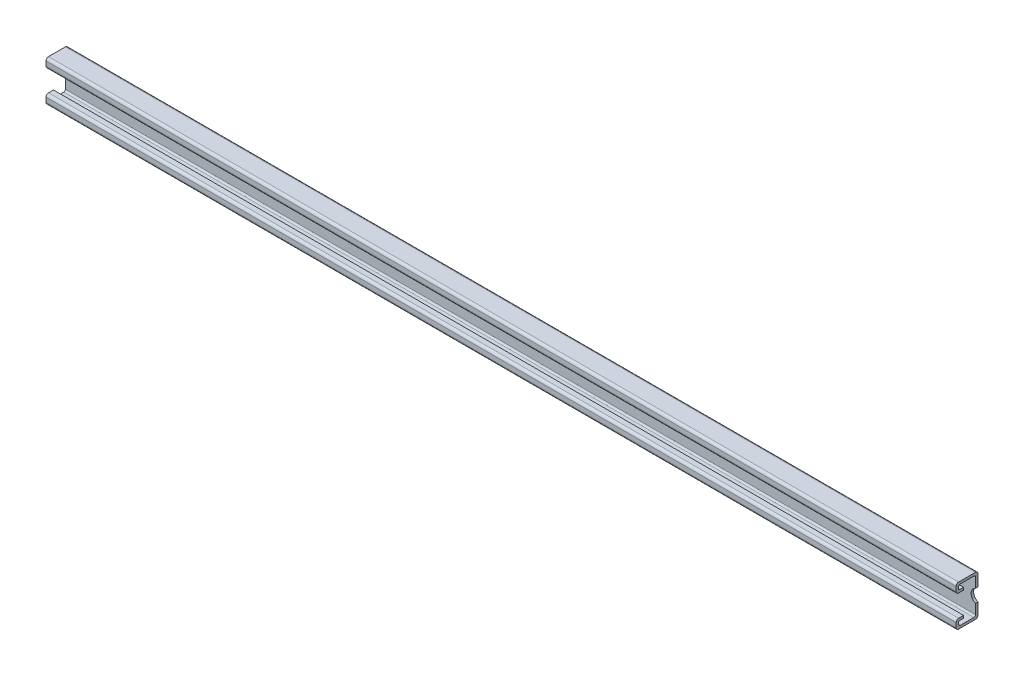
from build123d import *

# Parameters (mm, degrees)
SKETCH1_W           = 1000
SKETCH1_H           = 41
BOSS_EXTRUDE1_DEPTH = 22
CUT_EXTRUDE1_DEPTH  = 1001.900594465
SKETCH3_W           = 1000
SKETCH3_H           = 2.5
BOSS_EXTRUDE2_DEPTH = 5
CUT_EXTRUDE2_DEPTH  = 1002.08191473
CUT_EXTRUDE3_DEPTH  = 1002.08191473
CUT_EXTRUDE4_DEPTH  = 1002.08191473
CUT_EXTRUDE5_DEPTH  = 1002.08191473
CUT_EXTRUDE6_DEPTH  = 1002.08191473
CUT_EXTRUDE7_DEPTH  = 1002.08191473
CUT_EXTRUDE8_DEPTH  = 1002.08191473
CUT_EXTRUDE9_DEPTH  = 1002.08191473
CUT_EXTRUDE10_DEPTH = 1002.08191473
CUT_EXTRUDE11_DEPTH = 1002.08191473
CUT_EXTRUDE12_DEPTH = 1002.08191473
CUT_EXTRUDE13_DEPTH = 1002.08191473
CUT_EXTRUDE14_DEPTH = 1002.08191473
CUT_EXTRUDE15_DEPTH = 1002.08191473
CUT_EXTRUDE16_DEPTH = 1002.08191473
CUT_EXTRUDE17_DEPTH = 1002.08191473
CUT_EXTRUDE18_DEPTH = 1002.08191473
CUT_EXTRUDE19_DEPTH = 1002.08191473
CUT_EXTRUDE20_DEPTH = 1002.08191473
CUT_EXTRUDE21_DEPTH = 1002.08191473
FILLET1_R           = 1.2
FILLET2_R           = 1.6
FILLET3_R           = 2.5
SKETCH24_W          = 85.6
SKETCH24_H          = 22
CUT_EXTRUDE22_DEPTH = 1001.900594465


with BuildPart() as part:
    # Sketch1 → Boss-Extrude1 (new body)
    with BuildSketch(Plane(origin=(0, 0, -11), x_dir=(-1, 0, 0), z_dir=(0, 0, -1))):
        with Locations((-500, 20.5)):
            Rectangle(SKETCH1_W, SKETCH1_H)
    extrude(amount=-BOSS_EXTRUDE1_DEPTH)

    # Sketch2 → Cut-Extrude1 (cut, through all)
    with BuildSketch(Plane(origin=(1000, 0, 0), x_dir=(0, 0, -1), z_dir=(1, 0, 0))):
        Polygon((-11, 9.5), (-3.5, 9.5), (-3.5, 7), (-8.5, 7), (-8.5, 2.5), (8.5, 2.5), (8.5, 38.5), (-8.5, 38.5), (-8.5, 31.5), (-11, 31.5), align=None)
    extrude(amount=-CUT_EXTRUDE1_DEPTH, mode=Mode.SUBTRACT)

    # Sketch3 → Boss-Extrude2 (add)
    with BuildSketch(Plane(origin=(0, 0, 8.5), x_dir=(-1, 0, 0), z_dir=(0, 0, -1))):
        with Locations((-500, 32.75)):
            Rectangle(SKETCH3_W, SKETCH3_H)
    extrude(amount=BOSS_EXTRUDE2_DEPTH)

    # Sketch4 → Cut-Extrude2 (cut, through all)
    with BuildSketch(Plane(origin=(0, 0, -11), x_dir=(-1, 0, 0), z_dir=(0, 0, -1))):
        with BuildLine():
            Line((-117, 27.5), (-133, 27.5))
            ThreePointArc((-133, 27.5), (-140, 20.5), (-133, 13.5))
            Line((-133, 13.5), (-117, 13.5))
            ThreePointArc((-117, 13.5), (-110, 20.5), (-117, 27.5))
        make_face()
    extrude(amount=-CUT_EXTRUDE2_DEPTH, mode=Mode.SUBTRACT)

    # Sketch5 → Cut-Extrude3 (cut, through all)
    with BuildSketch(Plane(origin=(0, 0, -11), x_dir=(-1, 0, 0), z_dir=(0, 0, -1))):
        with BuildLine():
            Line((-217, 27.5), (-233, 27.5))
            ThreePointArc((-233, 27.5), (-240, 20.5), (-233, 13.5))
            Line((-233, 13.5), (-217, 13.5))
            ThreePointArc((-217, 13.5), (-210, 20.5), (-217, 27.5))
        make_face()
    extrude(amount=-CUT_EXTRUDE3_DEPTH, mode=Mode.SUBTRACT)

    # Sketch6 → Cut-Extrude4 (cut, through all)
    with BuildSketch(Plane(origin=(0, 0, -11), x_dir=(-1, 0, 0), z_dir=(0, 0, -1))):
        with BuildLine():
            Line((-317, 27.5), (-333, 27.5))
            ThreePointArc((-333, 27.5), (-340, 20.5), (-333, 13.5))
            Line((-333, 13.5), (-317, 13.5))
            ThreePointArc((-317, 13.5), (-310, 20.5), (-317, 27.5))
        make_face()
    extrude(amount=-CUT_EXTRUDE4_DEPTH, mode=Mode.SUBTRACT)

    # Sketch7 → Cut-Extrude5 (cut, through all)
    with BuildSketch(Plane(origin=(0, 0, -11), x_dir=(-1, 0, 0), z_dir=(0, 0, -1))):
        with BuildLine():
            Line((-417, 27.5), (-433, 27.5))
            ThreePointArc((-433, 27.5), (-440, 20.5), (-433, 13.5))
            Line((-433, 13.5), (-417, 13.5))
            ThreePointArc((-417, 13.5), (-410, 20.5), (-417, 27.5))
        make_face()
    extrude(amount=-CUT_EXTRUDE5_DEPTH, mode=Mode.SUBTRACT)

    # Sketch8 → Cut-Extrude6 (cut, through all)
    with BuildSketch(Plane(origin=(0, 0, -11), x_dir=(-1, 0, 0), z_dir=(0, 0, -1))):
        with BuildLine():
            Line((-517, 27.5), (-533, 27.5))
            ThreePointArc((-533, 27.5), (-540, 20.5), (-533, 13.5))
            Line((-533, 13.5), (-517, 13.5))
            ThreePointArc((-517, 13.5), (-510, 20.5), (-517, 27.5))
        make_face()
    extrude(amount=-CUT_EXTRUDE6_DEPTH, mode=Mode.SUBTRACT)

    # Sketch9 → Cut-Extrude7 (cut, through all)
    with BuildSketch(Plane(origin=(0, 0, -11), x_dir=(-1, 0, 0), z_dir=(0, 0, -1))):
        with BuildLine():
            Line((-617, 27.5), (-633, 27.5))
            ThreePointArc((-633, 27.5), (-640, 20.5), (-633, 13.5))
            Line((-633, 13.5), (-617, 13.5))
            ThreePointArc((-617, 13.5), (-610, 20.5), (-617, 27.5))
        make_face()
    extrude(amount=-CUT_EXTRUDE7_DEPTH, mode=Mode.SUBTRACT)

    # Sketch10 → Cut-Extrude8 (cut, through all)
    with BuildSketch(Plane(origin=(0, 0, -11), x_dir=(-1, 0, 0), z_dir=(0, 0, -1))):
        with BuildLine():
            Line((-717, 27.5), (-733, 27.5))
            ThreePointArc((-733, 27.5), (-740, 20.5), (-733, 13.5))
            Line((-733, 13.5), (-717, 13.5))
            ThreePointArc((-717, 13.5), (-710, 20.5), (-717, 27.5))
        make_face()
    extrude(amount=-CUT_EXTRUDE8_DEPTH, mode=Mode.SUBTRACT)

    # Sketch11 → Cut-Extrude9 (cut, through all)
    with BuildSketch(Plane(origin=(0, 0, -11), x_dir=(-1, 0, 0), z_dir=(0, 0, -1))):
        with BuildLine():
            Line((-817, 27.5), (-833, 27.5))
            ThreePointArc((-833, 27.5), (-840, 20.5), (-833, 13.5))
            Line((-833, 13.5), (-817, 13.5))
            ThreePointArc((-817, 13.5), (-810, 20.5), (-817, 27.5))
        make_face()
    extrude(amount=-CUT_EXTRUDE9_DEPTH, mode=Mode.SUBTRACT)

    # Sketch12 → Cut-Extrude10 (cut, through all)
    with BuildSketch(Plane(origin=(0, 0, -11), x_dir=(-1, 0, 0), z_dir=(0, 0, -1))):
        with BuildLine():
            Line((-917, 27.5), (-933, 27.5))
            ThreePointArc((-933, 27.5), (-940, 20.5), (-933, 13.5))
            Line((-933, 13.5), (-917, 13.5))
            ThreePointArc((-917, 13.5), (-910, 20.5), (-917, 27.5))
        make_face()
    extrude(amount=-CUT_EXTRUDE10_DEPTH, mode=Mode.SUBTRACT)

    # Sketch13 → Cut-Extrude11 (cut, through all)
    with BuildSketch(Plane(origin=(0, 0, -11), x_dir=(-1, 0, 0), z_dir=(0, 0, -1))):
        with BuildLine():
            Line((-17, 27.5), (-33, 27.5))
            ThreePointArc((-33, 27.5), (-40, 20.5), (-33, 13.5))
            Line((-33, 13.5), (-17, 13.5))
            ThreePointArc((-17, 13.5), (-10, 20.5), (-17, 27.5))
        make_face()
    extrude(amount=-CUT_EXTRUDE11_DEPTH, mode=Mode.SUBTRACT)

    # Sketch14 → Cut-Extrude12 (cut, through all)
    with BuildSketch(Plane(origin=(0, 0, -11), x_dir=(-1, 0, 0), z_dir=(0, 0, -1))):
        with BuildLine():
            Line((-967, 27.5), (-983, 27.5))
            ThreePointArc((-983, 27.5), (-990, 20.5), (-983, 13.5))
            Line((-983, 13.5), (-967, 13.5))
            ThreePointArc((-967, 13.5), (-960, 20.5), (-967, 27.5))
        make_face()
    extrude(amount=-CUT_EXTRUDE12_DEPTH, mode=Mode.SUBTRACT)

    # Sketch15 → Cut-Extrude13 (cut, through all)
    with BuildSketch(Plane(origin=(0, 0, -11), x_dir=(-1, 0, 0), z_dir=(0, 0, -1))):
        with BuildLine():
            Line((-867, 27.5), (-883, 27.5))
            ThreePointArc((-883, 27.5), (-890, 20.5), (-883, 13.5))
            Line((-883, 13.5), (-867, 13.5))
            ThreePointArc((-867, 13.5), (-860, 20.5), (-867, 27.5))
        make_face()
    extrude(amount=-CUT_EXTRUDE13_DEPTH, mode=Mode.SUBTRACT)

    # Sketch16 → Cut-Extrude14 (cut, through all)
    with BuildSketch(Plane(origin=(0, 0, -11), x_dir=(-1, 0, 0), z_dir=(0, 0, -1))):
        with BuildLine():
            Line((-767, 27.5), (-783, 27.5))
            ThreePointArc((-783, 27.5), (-790, 20.5), (-783, 13.5))
            Line((-783, 13.5), (-767, 13.5))
            ThreePointArc((-767, 13.5), (-760, 20.5), (-767, 27.5))
        make_face()
    extrude(amount=-CUT_EXTRUDE14_DEPTH, mode=Mode.SUBTRACT)

    # Sketch17 → Cut-Extrude15 (cut, through all)
    with BuildSketch(Plane(origin=(0, 0, -11), x_dir=(-1, 0, 0), z_dir=(0, 0, -1))):
        with BuildLine():
            Line((-667, 27.5), (-683, 27.5))
            ThreePointArc((-683, 27.5), (-690, 20.5), (-683, 13.5))
            Line((-683, 13.5), (-667, 13.5))
            ThreePointArc((-667, 13.5), (-660, 20.5), (-667, 27.5))
        make_face()
    extrude(amount=-CUT_EXTRUDE15_DEPTH, mode=Mode.SUBTRACT)

    # Sketch18 → Cut-Extrude16 (cut, through all)
    with BuildSketch(Plane(origin=(0, 0, -11), x_dir=(-1, 0, 0), z_dir=(0, 0, -1))):
        with BuildLine():
            Line((-567, 27.5), (-583, 27.5))
            ThreePointArc((-583, 27.5), (-590, 20.5), (-583, 13.5))
            Line((-583, 13.5), (-567, 13.5))
            ThreePointArc((-567, 13.5), (-560, 20.5), (-567, 27.5))
        make_face()
    extrude(amount=-CUT_EXTRUDE16_DEPTH, mode=Mode.SUBTRACT)

    # Sketch19 → Cut-Extrude17 (cut, through all)
    with BuildSketch(Plane(origin=(0, 0, -11), x_dir=(-1, 0, 0), z_dir=(0, 0, -1))):
        with BuildLine():
            Line((-467, 27.5), (-483, 27.5))
            ThreePointArc((-483, 27.5), (-490, 20.5), (-483, 13.5))
            Line((-483, 13.5), (-467, 13.5))
            ThreePointArc((-467, 13.5), (-460, 20.5), (-467, 27.5))
        make_face()
    extrude(amount=-CUT_EXTRUDE17_DEPTH, mode=Mode.SUBTRACT)

    # Sketch20 → Cut-Extrude18 (cut, through all)
    with BuildSketch(Plane(origin=(0, 0, -11), x_dir=(-1, 0, 0), z_dir=(0, 0, -1))):
        with BuildLine():
            Line((-367, 27.5), (-383, 27.5))
            ThreePointArc((-383, 27.5), (-390, 20.5), (-383, 13.5))
            Line((-383, 13.5), (-367, 13.5))
            ThreePointArc((-367, 13.5), (-360, 20.5), (-367, 27.5))
        make_face()
    extrude(amount=-CUT_EXTRUDE18_DEPTH, mode=Mode.SUBTRACT)

    # Sketch21 → Cut-Extrude19 (cut, through all)
    with BuildSketch(Plane(origin=(0, 0, -11), x_dir=(-1, 0, 0), z_dir=(0, 0, -1))):
        with BuildLine():
            Line((-267, 27.5), (-283, 27.5))
            ThreePointArc((-283, 27.5), (-290, 20.5), (-283, 13.5))
            Line((-283, 13.5), (-267, 13.5))
            ThreePointArc((-267, 13.5), (-260, 20.5), (-267, 27.5))
        make_face()
    extrude(amount=-CUT_EXTRUDE19_DEPTH, mode=Mode.SUBTRACT)

    # Sketch22 → Cut-Extrude20 (cut, through all)
    with BuildSketch(Plane(origin=(0, 0, -11), x_dir=(-1, 0, 0), z_dir=(0, 0, -1))):
        with BuildLine():
            Line((-167, 27.5), (-183, 27.5))
            ThreePointArc((-183, 27.5), (-190, 20.5), (-183, 13.5))
            Line((-183, 13.5), (-167, 13.5))
            ThreePointArc((-167, 13.5), (-160, 20.5), (-167, 27.5))
        make_face()
    extrude(amount=-CUT_EXTRUDE20_DEPTH, mode=Mode.SUBTRACT)

    # Sketch23 → Cut-Extrude21 (cut, through all)
    with BuildSketch(Plane(origin=(0, 0, -11), x_dir=(-1, 0, 0), z_dir=(0, 0, -1))):
        with BuildLine():
            Line((-67, 27.5), (-83, 27.5))
            ThreePointArc((-83, 27.5), (-90, 20.5), (-83, 13.5))
            Line((-83, 13.5), (-67, 13.5))
            ThreePointArc((-67, 13.5), (-60, 20.5), (-67, 27.5))
        make_face()
    extrude(amount=-CUT_EXTRUDE21_DEPTH, mode=Mode.SUBTRACT)

    # Fillet1
    fillet1_edges = [part.edges().sort_by_distance(p)[0] for p in [
        (500, 7, 8.5),
        (500, 34, 8.5),
    ]]
    fillet(fillet1_edges, radius=FILLET1_R)

    # Fillet2
    fillet2_edges = [part.edges().sort_by_distance(p)[0] for p in [
        (500, 38.5, 8.5),
        (500, 38.5, -8.5),
        (500, 2.5, -8.5),
        (500, 2.5, 8.5),
    ]]
    fillet(fillet2_edges, radius=FILLET2_R)

    # Fillet3
    fillet3_edges = [part.edges().sort_by_distance(p)[0] for p in [
        (500, 41, 11),
        (500, 9.5, 11),
        (500, 31.5, 11),
        (500, 0, 11),
        (500, 41, -11),
        (500, 0, -11),
    ]]
    fillet(fillet3_edges, radius=FILLET3_R)

    # Sketch24 → Cut-Extrude22 (cut, through all)
    with BuildSketch(Plane(origin=(0, 41, 0), x_dir=(1, 0, 0), z_dir=(0, 1, 0))):
        with Locations((957.2, 0)):
            Rectangle(SKETCH24_W, SKETCH24_H)
    extrude(amount=-CUT_EXTRUDE22_DEPTH, mode=Mode.SUBTRACT)


solid = part.part
